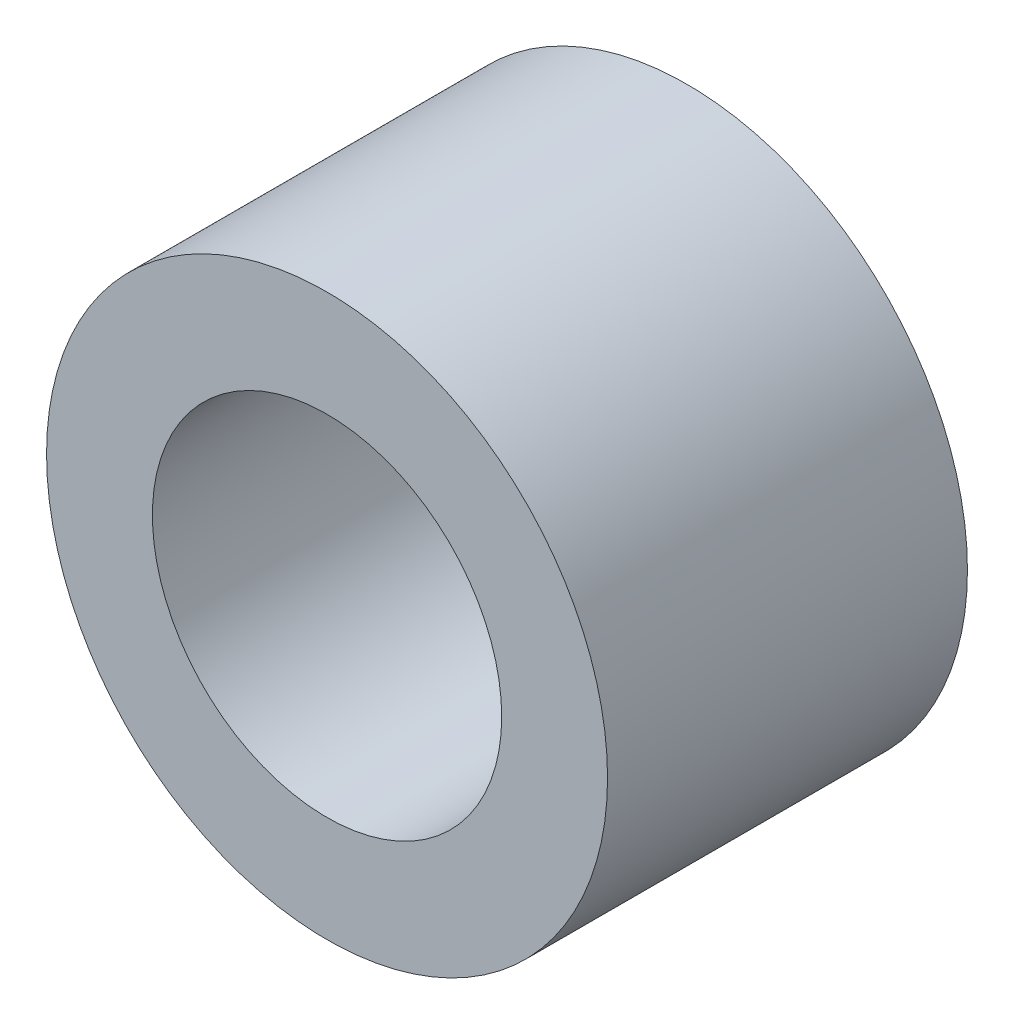
from build123d import *

# Parameters (mm, degrees)
SKETCH_1_R      = 2.65
SKETCH_1_R_2    = 1.65
EXTRUDE_1_DEPTH = 3.4


with BuildPart() as part:
    # Эскиз1 → Бобышка-Вытянуть1 (new body)
    with BuildSketch(Plane.XY):
        Circle(SKETCH_1_R)
        Circle(SKETCH_1_R_2, mode=Mode.SUBTRACT)
    extrude(amount=EXTRUDE_1_DEPTH)


solid = part.part
